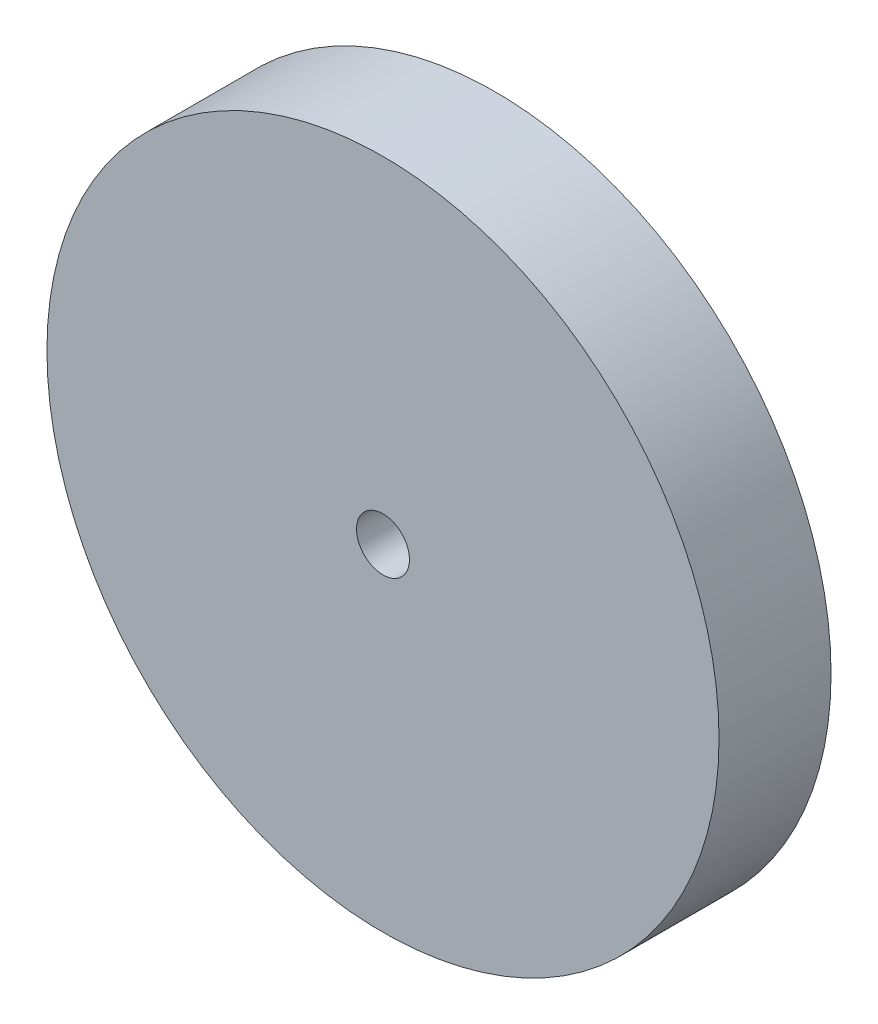
from build123d import *

# Parameters (mm, degrees)
SKETCH1_R           = 38.1
SKETCH1_R_2         = 3
BOSS_EXTRUDE1_DEPTH = 12.7
SKETCH2_R           = 7.9375
CUT_EXTRUDE1_DEPTH  = 5.08


with BuildPart() as part:
    # Sketch1 → Boss-Extrude1 (new body)
    with BuildSketch(Plane.XY):
        Circle(SKETCH1_R)
        Circle(SKETCH1_R_2, mode=Mode.SUBTRACT)
    extrude(amount=BOSS_EXTRUDE1_DEPTH)

    # Sketch2 → Cut-Extrude1 (cut)
    with BuildSketch(Plane(origin=(0, 0, 0), x_dir=(-1, 0, 0), z_dir=(0, 0, -1))):
        Circle(SKETCH2_R)
    extrude(amount=-CUT_EXTRUDE1_DEPTH, mode=Mode.SUBTRACT)


solid = part.part
